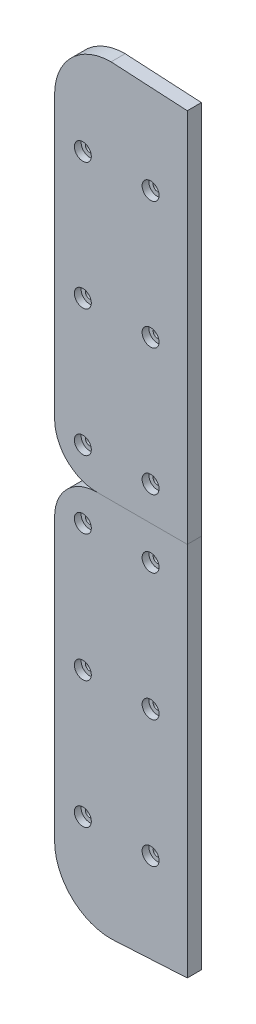
from build123d import *

# Parameters (mm, degrees)
DODANIE_WYCI_GNI_CIE1_DEPTH = 5
SZKIC1_R                    = 3.5
WYTNIJ_WYCI_GNI_CIE1_DEPTH  = 88.4
SZKIC3_R                    = 1.5
WYTNIJ_WYCI_GNI_CIE3_DEPTH  = 5
SZKIC5_R                    = 3
WYTNIJ_WYCI_GNI_CIE4_DEPTH  = 2.4
WYTNIJ_WYCI_GNI_CIE5_START  = -5
SZKIC6_R                    = 3.5
WYTNIJ_WYCI_GNI_CIE5_DEPTH  = 5
WYTNIJ_WYCI_GNI_CIE6_START  = -5
SZKIC8_R                    = 3.5
WYTNIJ_WYCI_GNI_CIE6_DEPTH  = 5
SZKIC9_R                    = 1.5
WYTNIJ_WYCI_GNI_CIE7_DEPTH  = 3
SZKIC10_R                   = 2.85
WYTNIJ_WYCI_GNI_CIE8_DEPTH  = 2
SZKIC11_W                   = 7
SZKIC11_H                   = 5
WYTNIJ_WYCI_GNI_CIE9_DEPTH  = 3.5


with BuildPart() as part:
    # outer-wire → Dodanie-wyciągnięcie1 (new body)
    with BuildSketch(Plane.XY):
        with BuildLine():
            Line((-24, -24.53020641), (8, -24.53020641))
            Line((8, -24.53020641), (8, 108.504576357))
            Line((8, 108.504576357), (-19, 110))
            ThreePointArc((-19, 110), (-33.142135624, 104.142135624), (-39, 90))
            Line((-39, 90), (-39, -9.53020641))
            ThreePointArc((-39, -9.53020641), (-34.606601718, -20.136808128), (-24, -24.53020641))
        make_face()
    extrude(amount=DODANIE_WYCI_GNI_CIE1_DEPTH)

    # Szkic1 → Wytnij-wyciągnięcie1 (cut)
    with BuildSketch(Plane(origin=(0, -24.53020641, 0), x_dir=(-1, 0, 0), z_dir=(0, -1, 0))):
        with Locations((19, 0)):
            Circle(SZKIC1_R)
    extrude(amount=-WYTNIJ_WYCI_GNI_CIE1_DEPTH, mode=Mode.SUBTRACT)

    # Szkic3 → Wytnij-wyciągnięcie3 (cut)
    with BuildSketch(Plane.XY.offset(5)):
        with Locations((-5, 77.5)):
            Circle(SZKIC3_R)
        with Locations((-29, 77.5)):
            Circle(SZKIC3_R)
        with Locations((-29, -12.5)):
            Circle(SZKIC3_R)
        with Locations((-29, 32.5)):
            Circle(SZKIC3_R)
        with Locations((-5, 32.5)):
            Circle(SZKIC3_R)
        with Locations((-5, -12.5)):
            Circle(SZKIC3_R)
    extrude(amount=-WYTNIJ_WYCI_GNI_CIE3_DEPTH, mode=Mode.SUBTRACT)

    # Szkic5 → Wytnij-wyciągnięcie4 (cut)
    with BuildSketch(Plane.XY.offset(5)):
        with Locations((-29, -12.5)):
            Circle(SZKIC5_R)
        with Locations((-29, 32.5)):
            Circle(SZKIC5_R)
        with Locations((-29, 77.5)):
            Circle(SZKIC5_R)
        with Locations((-5, 77.5)):
            Circle(SZKIC5_R)
        with Locations((-5, 32.5)):
            Circle(SZKIC5_R)
        with Locations((-5, -12.5)):
            Circle(SZKIC5_R)
    extrude(amount=-WYTNIJ_WYCI_GNI_CIE4_DEPTH, mode=Mode.SUBTRACT)


with BuildPart() as body_2:
    # Lustro5: mirrored copy
    add(part.part.mirror(Plane(origin=(-24, -24.53020641, 5), x_dir=(0, 0, 1), z_dir=(0, 1, 0))))

    # Szkic6 → Wytnij-wyciągnięcie5 (cut)
    with BuildSketch(Plane(origin=(0, -114.43020641, 0), x_dir=(1, 0, 0), z_dir=(0, 1, 0)).offset(WYTNIJ_WYCI_GNI_CIE5_START)):
        with Locations((-19, 0)):
            Circle(SZKIC6_R)
    extrude(amount=WYTNIJ_WYCI_GNI_CIE5_DEPTH, mode=Mode.SUBTRACT)

    # Szkic8 → Wytnij-wyciągnięcie6 (cut)
    with BuildSketch(Plane(origin=(0, -122.43020641, 0), x_dir=(1, 0, 0), z_dir=(0, 1, 0)).offset(WYTNIJ_WYCI_GNI_CIE6_START)):
        with Locations((-19, 0)):
            Circle(SZKIC8_R)
    extrude(amount=WYTNIJ_WYCI_GNI_CIE6_DEPTH, mode=Mode.SUBTRACT)

    # Szkic9 → Wytnij-wyciągnięcie7 (cut)
    with BuildSketch(Plane(origin=(0, -122.43020641, 0), x_dir=(1, 0, 0), z_dir=(0, 1, 0))):
        with Locations((-19, 0)):
            Circle(SZKIC9_R)
    extrude(amount=WYTNIJ_WYCI_GNI_CIE7_DEPTH, mode=Mode.SUBTRACT)

    # Szkic10 → Wytnij-wyciągnięcie8 (cut)
    with BuildSketch(Plane(origin=(0, -114.43020641, 0), x_dir=(1, 0, 0), z_dir=(0, 1, 0))):
        with Locations((-19, 0)):
            Circle(SZKIC10_R)
    extrude(amount=WYTNIJ_WYCI_GNI_CIE8_DEPTH, mode=Mode.SUBTRACT)

    # Szkic11 → Wytnij-wyciągnięcie9 (cut)
    with BuildSketch(Plane(origin=(0, 0, 0), x_dir=(-1, 0, 0), z_dir=(0, 0, -1))):
        with Locations((19, -116.93020641)):
            Rectangle(SZKIC11_W, SZKIC11_H)
        with Locations((19, -124.93020641)):
            Rectangle(SZKIC11_W, SZKIC11_H)
    extrude(amount=-WYTNIJ_WYCI_GNI_CIE9_DEPTH, mode=Mode.SUBTRACT)


solid = Compound([part.part, body_2.part])
